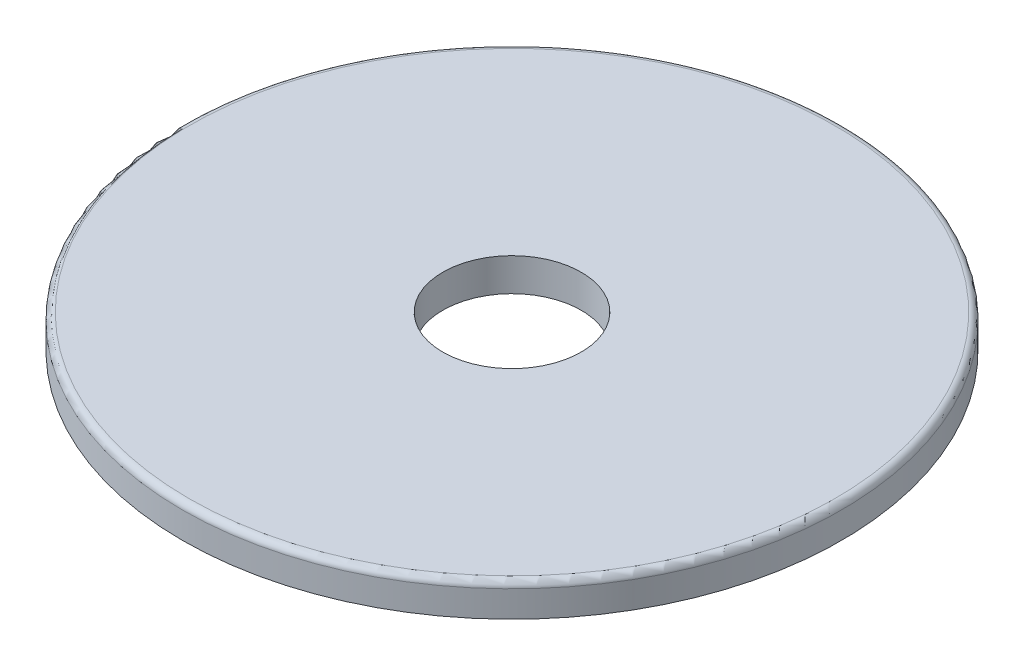
from build123d import *

# Parameters (mm, degrees)
SKETCH_1_R      = 10
SKETCH_1_R_2    = 2.1
EXTRUDE_1_DEPTH = 1
FILLET_1_R      = 0.2


with BuildPart() as part:
    # 草图1 → 凸台-拉伸1 (new body)
    with BuildSketch(Plane(origin=(0, 0, 0), x_dir=(1, 0, 0), z_dir=(0, 1, 0))):
        with Locations(Location((0, 0, 0), (0, 0, 270))):
            Circle(SKETCH_1_R)
        with Locations(Location((0, 0, 0), (0, 0, 270))):
            Circle(SKETCH_1_R_2, mode=Mode.SUBTRACT)
    extrude(amount=EXTRUDE_1_DEPTH)

    # 圆角1
    fillet_1_edges = [part.edges().sort_by_distance(p)[0] for p in [
        (0, 1, -10),
    ]]
    fillet(fillet_1_edges, radius=FILLET_1_R)


solid = part.part
